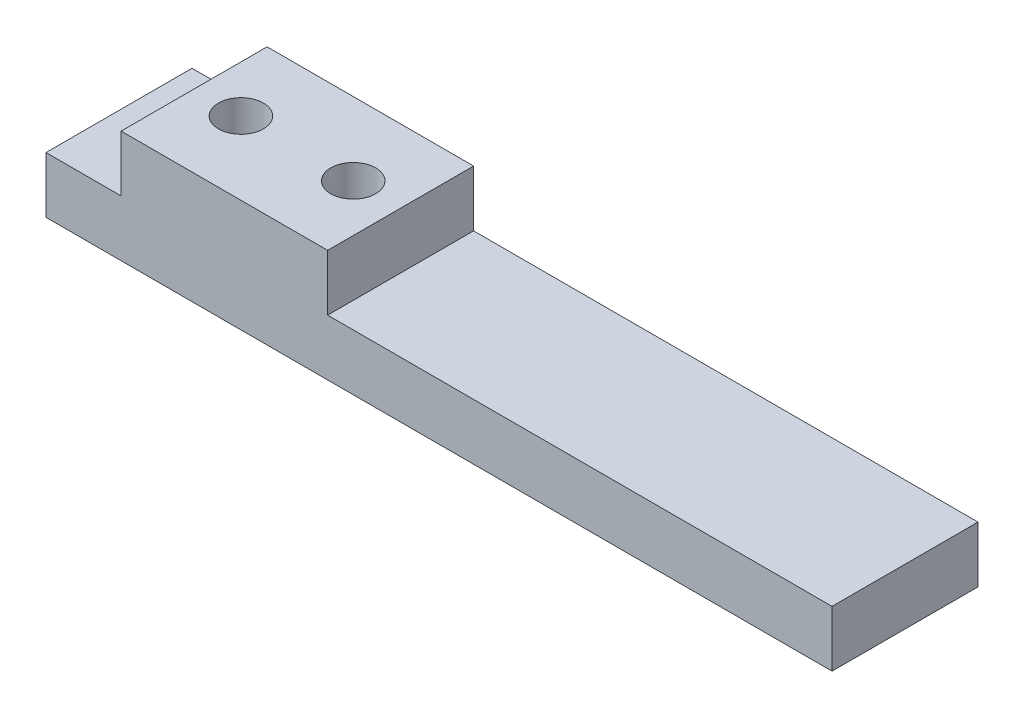
from build123d import *

# Parameters (mm, degrees)
SKETCH1_W           = 70
SKETCH1_H           = 13
BOSS_EXTRUDE1_DEPTH = 5
SKETCH2_R           = 2
CUT_EXTRUDE1_DEPTH  = 36.947878936
BOSS_EXTRUDE3_START = 5
SKETCH2_3_W         = 18.390349325
SKETCH2_3_H         = 13
SKETCH2_3_R         = 2
BOSS_EXTRUDE3_DEPTH = 5


with BuildPart() as part:
    # Sketch1 → Boss-Extrude1 (new body)
    with BuildSketch(Plane(origin=(0, 0, 0), x_dir=(1, 0, 0), z_dir=(0, 1, 0))):
        Rectangle(SKETCH1_W, SKETCH1_H)
    extrude(amount=BOSS_EXTRUDE1_DEPTH)

    # Sketch2 → Cut-Extrude1 (cut, through all)
    with BuildSketch(Plane(origin=(0, 5, 0), x_dir=(1, 0, 0), z_dir=(0, 1, 0))):
        with Locations((-24.141309667, 0)):
            Circle(SKETCH2_R)
        with Locations((-14.141309667, 0)):
            Circle(SKETCH2_R)
    extrude(amount=-CUT_EXTRUDE1_DEPTH, mode=Mode.SUBTRACT)

    # Sketch2<3> → Boss-Extrude3 (add)
    with BuildSketch(Plane(origin=(0, 5, 0), x_dir=(1, 0, 0), z_dir=(0, 1, 0)).offset(BOSS_EXTRUDE3_START)):
        with Locations((-19.114378827, 0)):
            Rectangle(SKETCH2_3_W, SKETCH2_3_H)
        with Locations((-24.141309667, 0)):
            Circle(SKETCH2_3_R, mode=Mode.SUBTRACT)
        with Locations((-14.141309667, 0)):
            Circle(SKETCH2_3_R, mode=Mode.SUBTRACT)
    extrude(amount=-BOSS_EXTRUDE3_DEPTH)


solid = part.part
